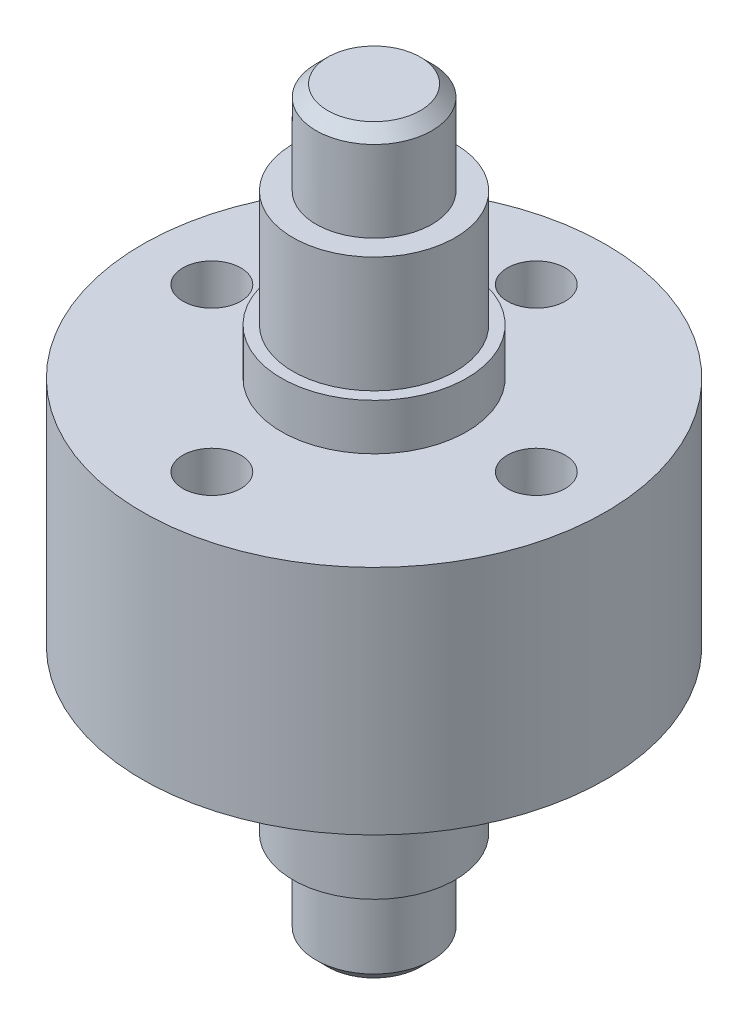
from build123d import *

# Parameters (mm, degrees)
HOLE_WIZARD_M3_1_D = 2.5
CHAMFER_1_SIZE     = 0.5


with BuildPart() as part:
    # 草图1 → 旋转1 (revolve)
    with BuildSketch(Plane.XY, mode=Mode.PRIVATE) as revolve_1_sk:
        Polygon((0, 0), (0, 32), (2.5, 32), (2.5, 28), (3.5, 28), (3.5, 23), (4, 23), (4, 21), (10, 21), (10, 11), (4, 11), (4, 9), (3.5, 9), (3.5, 4), (2.5, 4), (2.5, 0), align=None)
    revolve(revolve_1_sk.sketch.rotate(Axis((0, 0, 0), (0, 1, 0)), 90), axis=Axis((0, 0, 0), (0, 1, 0)))

    # M3 螺纹孔1 (through all)
    with Locations(Plane(origin=(0, 21, 0), x_dir=(1, 0, 0), z_dir=(0, 1, 0))):
        with Locations((0, 7), (7, 0), (0, -7), (-7, 0)):
            Hole(HOLE_WIZARD_M3_1_D / 2)

    # 倒角1
    chamfer_1_edges = [part.edges().sort_by_distance(p)[0] for p in [
        (0, 0, 2.5),
        (0, 32, 2.5),
    ]]
    chamfer(chamfer_1_edges, length=CHAMFER_1_SIZE)


solid = part.part
